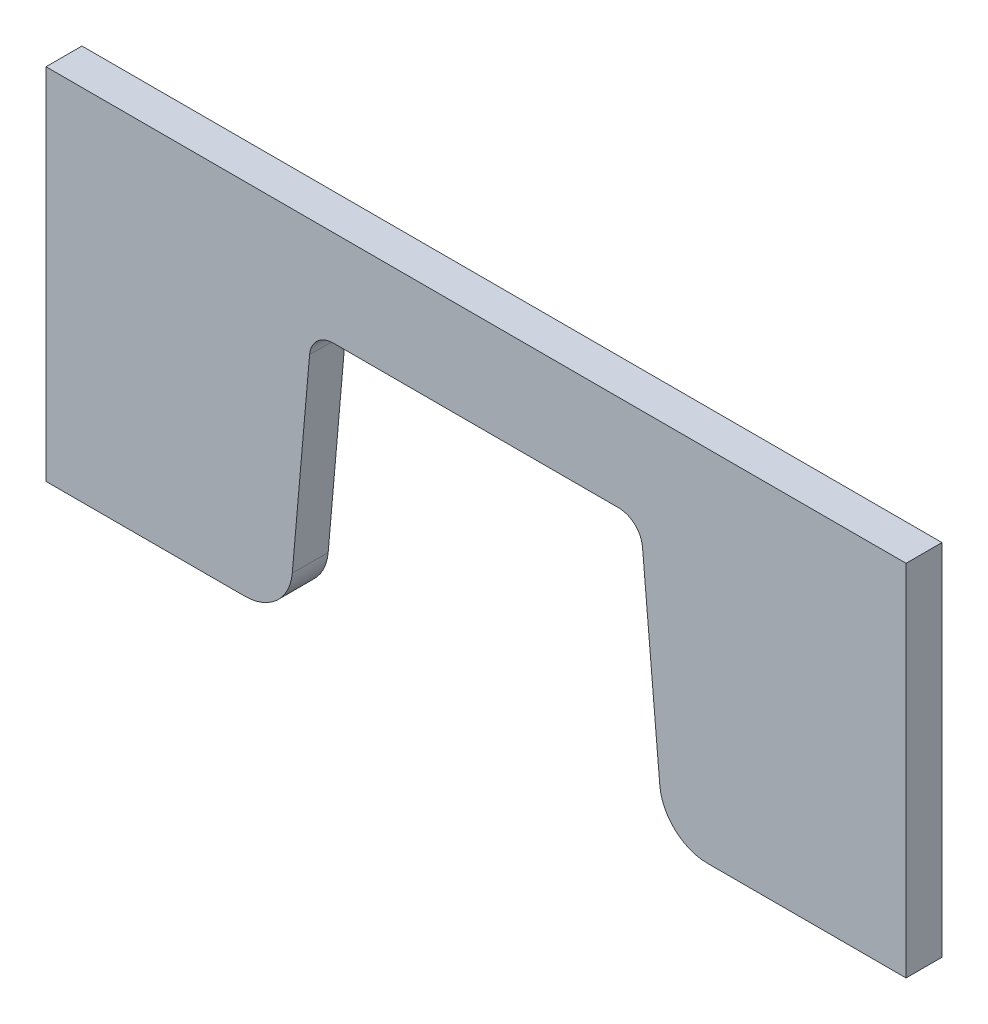
from build123d import *

# Parameters (mm, degrees)
BOSS_EXTRUDE1_DEPTH = 19.05


with BuildPart() as part:
    # Sketch1 → Boss-Extrude1 (new body)
    with BuildSketch(Plane.XY):
        with BuildLine():
            Line((-228.088766336, -463.55), (-126.488766336, -463.55))
            Line((-126.488766336, -463.55), (-122.776078156, -463.55))
            ThreePointArc((-122.776078156, -463.55), (-118.207935902, -463.135837515), (-113.788766336, -461.906856405))
            ThreePointArc((-113.788766336, -461.906856405), (-102.527903247, -453.485299567), (-97.472732825, -440.363755866))
            Line((-97.472732825, -440.363755866), (-88.289138704, -335.394794733))
            ThreePointArc((-88.289138704, -335.394794733), (-84.217461675, -327.138250488), (-75.637466038, -323.801672666))
            Line((-75.637466038, -323.801672666), (-61.874871948, -323.801672666))
            Line((-61.874871948, -323.801672666), (61.874871948, -323.801672666))
            Line((61.874871948, -323.801672666), (75.637466038, -323.801672666))
            ThreePointArc((75.637466038, -323.801672666), (84.217461675, -327.138250488), (88.289138704, -335.394794733))
            Line((88.289138704, -335.394794733), (97.472732825, -440.363755866))
            ThreePointArc((97.472732825, -440.363755866), (102.527903247, -453.485299567), (113.788766336, -461.906856405))
            ThreePointArc((113.788766336, -461.906856405), (118.207935902, -463.135837515), (122.776078156, -463.55))
            Line((122.776078156, -463.55), (126.488766336, -463.55))
            Line((126.488766336, -463.55), (228.088766336, -463.55))
            Line((228.088766336, -463.55), (228.088766336, -273.05))
            Line((228.088766336, -273.05), (-228.088766336, -273.05))
            Line((-228.088766336, -273.05), (-228.088766336, -463.55))
        make_face()
    extrude(amount=BOSS_EXTRUDE1_DEPTH)


solid = part.part
